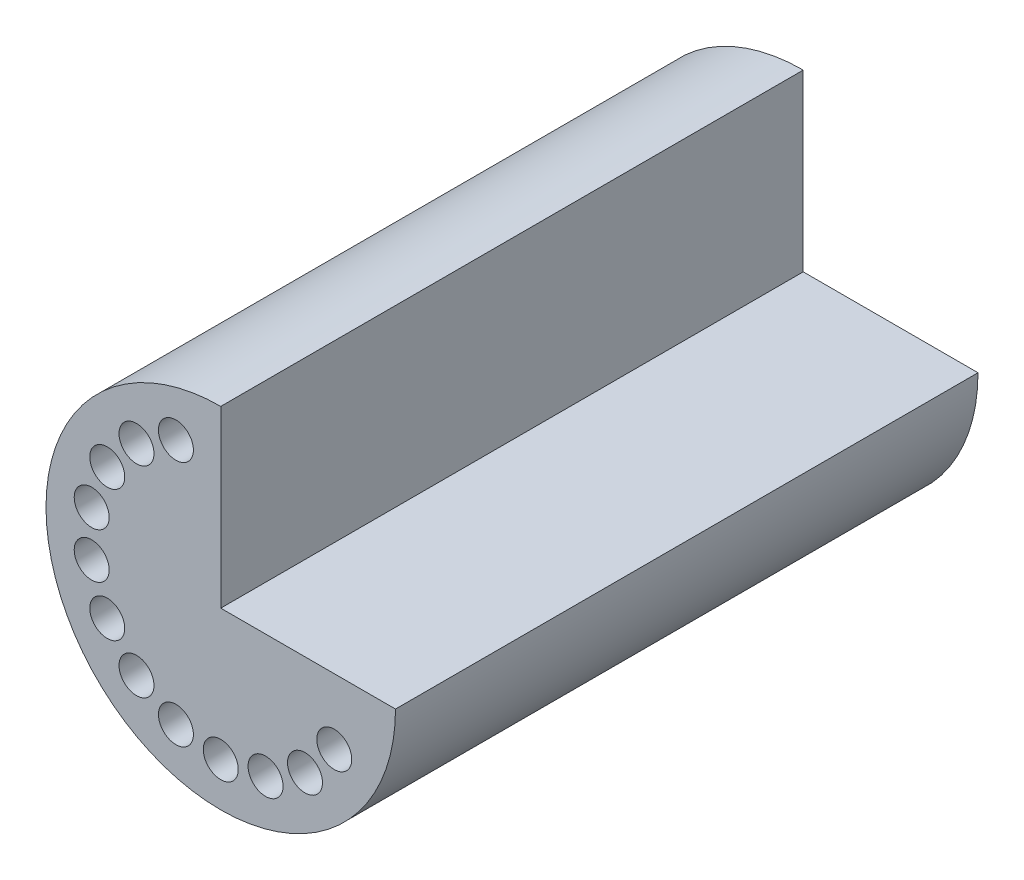
from build123d import *

# Parameters (mm, degrees)
SKETCH1_R           = 150
BOSS_EXTRUDE1_DEPTH = 500
SKETCH2_W           = 150
SKETCH2_H           = 150
CUT_EXTRUDE1_DEPTH  = 544.13902456
SKETCH3_R           = 15
CUT_EXTRUDE2_DEPTH  = 544.13902456
CIRPATTERN1_COUNT   = 12
CIRPATTERN1_ANGLE   = 220


with BuildPart() as part:
    # Sketch1 → Boss-Extrude1 (new body)
    with BuildSketch(Plane.XY):
        Circle(SKETCH1_R)
    extrude(amount=-BOSS_EXTRUDE1_DEPTH)

    # Sketch2 → Cut-Extrude1 (cut, through all)
    with BuildSketch(Plane.XY):
        with Locations((75, 75)):
            Rectangle(SKETCH2_W, SKETCH2_H)
    extrude(amount=-CUT_EXTRUDE1_DEPTH, mode=Mode.SUBTRACT)

    # Sketch3 → Cut-Extrude2 (cut, through all)
    with BuildSketch(Plane.XY):
        with Locations((-38.477266124, 105.715419838)):
            Circle(SKETCH3_R)
    cut_extrude2 = extrude(amount=-CUT_EXTRUDE2_DEPTH, mode=Mode.SUBTRACT)

    # CirPattern1: Cut-Extrude2 ×12 about axis
    cirpattern1_axis = Axis((0, 0, 0), (0, 0, 1))
    for i in range(1, CIRPATTERN1_COUNT):
        add(cut_extrude2.rotate(cirpattern1_axis, i * CIRPATTERN1_ANGLE / (CIRPATTERN1_COUNT - 1)), mode=Mode.SUBTRACT)


solid = part.part
